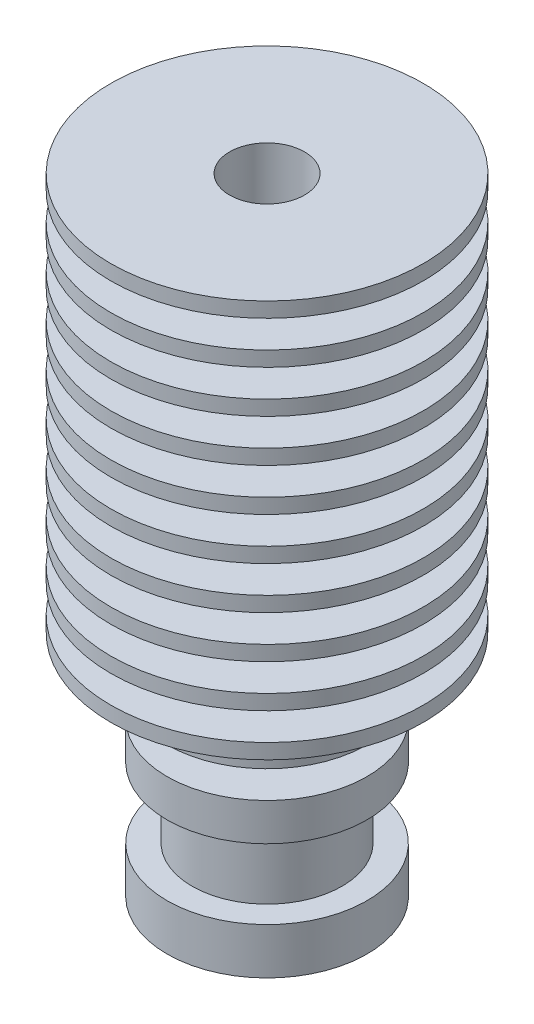
from build123d import *


with BuildPart() as part:
    # Sketch1 → Revolve1 (revolve)
    with BuildSketch(Plane.XY, mode=Mode.PRIVATE) as revolve1_sk:
        Polygon((0, 0), (8, 0), (8, 3.7), (6, 3.7), (6, 9.3), (8, 9.3), (8, 12.3), (4.5, 12.3), (4.5, 14.5), (8, 14.5), (8, 16.1), (4.5, 16.1), (4.5, 18.3), (12.5, 18.3), (12.5, 19.5), (4.5, 19.5), (4.5, 21.7), (12.5, 21.7), (12.5, 22.9), (4.5, 22.9), (4.5, 25.1), (12.5, 25.1), (12.5, 26.3), (4.5, 26.3), (4.5, 28.5), (12.5, 28.5), (12.5, 29.7), (6.5, 29.7), (6.5, 31.9), (12.5, 31.9), (12.5, 33.1), (7.5, 33.1), (7.5, 35.3), (12.5, 35.3), (12.5, 36.5), (7.5, 36.5), (7.5, 38.7), (12.5, 38.7), (12.5, 39.9), (7.5, 39.9), (7.5, 42.1), (12.5, 42.1), (12.5, 43.3), (7.5, 43.3), (7.5, 45.5), (12.5, 45.5), (12.5, 46.7), (7.5, 46.7), (7.5, 48.9), (12.5, 48.9), (12.5, 50.1), (9.200701829, 50.1), (0, 50.1), align=None)
    revolve(revolve1_sk.sketch.rotate(Axis((0, 50.1, 0), (0, -1, 0)), 90), axis=Axis((0, 50.1, 0), (0, -1, 0)))

    # Sketch2 → Cut-Revolve2 (revolve, cut)
    with BuildSketch(Plane.XY, mode=Mode.PRIVATE) as cut_revolve2_sk:
        Polygon((3.2, 0), (3.2, 10), (1.872094381, 12.3), (1.872094381, 18.3), (1, 19.5), (1, 32.1), (1.9, 32.1), (3, 32.735085296), (3, 50.1), (0, 50.1), (0, 0), align=None)
    revolve(cut_revolve2_sk.sketch.rotate(Axis((0, 50.1, 0), (0, -1, 0)), 90), axis=Axis((0, 50.1, 0), (0, -1, 0)), mode=Mode.SUBTRACT)


solid = part.part
